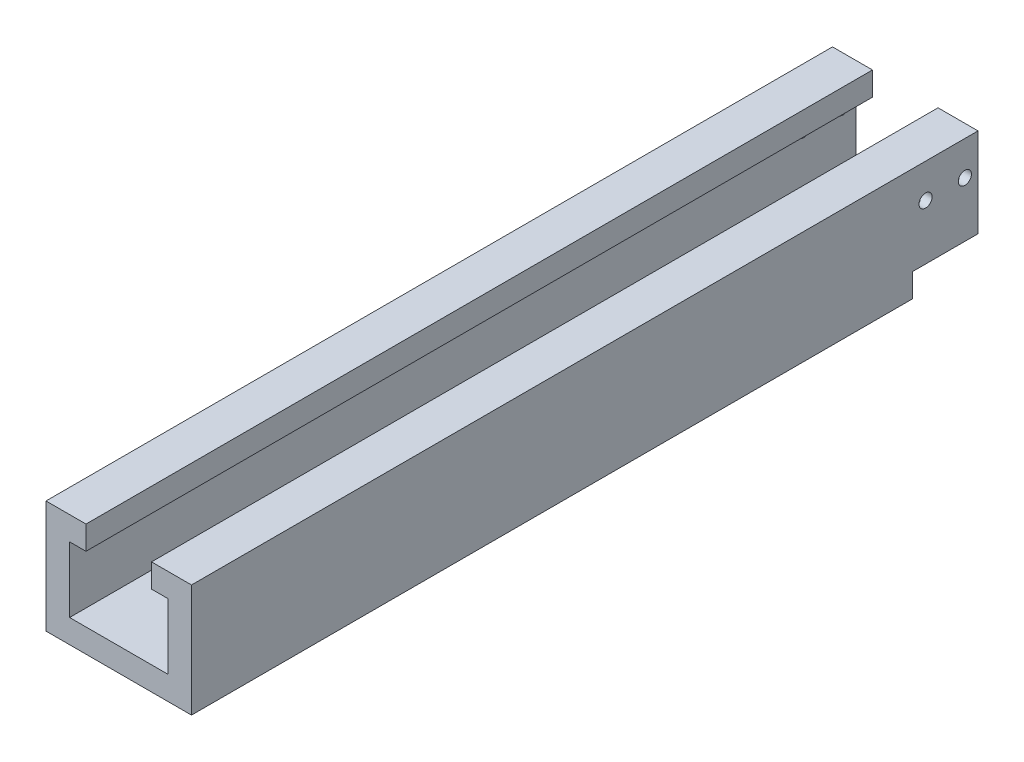
from build123d import *

# Parameters (mm, degrees)
SKETCH1_W                                  = 111
SKETCH1_H                                  = 18
BASEPLATE_DEPTH                            = 600
SKETCH2_W                                  = 18
SKETCH2_H                                  = 600
SIDE_RAIL_DEPTH                            = 50
SKETCH3_W                                  = 30.5
SKETCH3_H                                  = 600
KEEPER_RAIL_DEPTH                          = 18
SKETCH5_W                                  = 111
SKETCH5_H                                  = 50
LAP_JOINT_CUTOUT_DEPTH                     = 18
LAP_JOINT_BOLT_HOLE_PATTERN_D              = 6.6
LAP_JOINT_BOLT_HOLE_PATTERN_DEPTH          = 57
LAP_JOINT_BOLT_HOLE_PATTERN_TIP            = 1.982840043
FIXED_BEARING_BLOCK_BOLT_CLEARANCE_HOLES_D = 6.6
CROSS_DOWEL_BOLT_CLEARANCE_HOLES_D         = 10


with BuildPart() as part:
    # Sketch1 → baseplate (new body)
    with BuildSketch(Plane.XY):
        with Locations((55.5, 9)):
            Rectangle(SKETCH1_W, SKETCH1_H)
    extrude(amount=BASEPLATE_DEPTH)

    # Sketch2 → side_rail (add)
    with BuildSketch(Plane(origin=(0, 18, 0), x_dir=(1, 0, 0), z_dir=(0, 1, 0))):
        with Locations((9, -300)):
            Rectangle(SKETCH2_W, SKETCH2_H)
    side_rail = extrude(amount=SIDE_RAIL_DEPTH)

    # Sketch3 → keeper rail (add)
    with BuildSketch(Plane(origin=(0, 68, 0), x_dir=(1, 0, 0), z_dir=(0, 1, 0))):
        with Locations((15.25, -300)):
            Rectangle(SKETCH3_W, SKETCH3_H)
    keeper_rail = extrude(amount=KEEPER_RAIL_DEPTH)

    # mirror rails: side_rail, keeper rail across plane
    add(side_rail.mirror(Plane.ZY.offset(-55.5)))
    add(keeper_rail.mirror(Plane.ZY.offset(-55.5)))

    # Sketch5 → lap joint cutout (cut)
    with BuildSketch(Plane.XZ):
        with Locations((55.5, 25)):
            Rectangle(SKETCH5_W, SKETCH5_H)
    extrude(amount=-LAP_JOINT_CUTOUT_DEPTH, mode=Mode.SUBTRACT)

    # lap joint bolt hole pattern
    with Locations(Plane(origin=(0, 18, 0), x_dir=(-1, 0, 0), z_dir=(0, -1, 0))):
        with Locations((-102, -10), (-9, -40), (-102, -40), (-9, -10)):
            Hole(LAP_JOINT_BOLT_HOLE_PATTERN_D / 2, depth=LAP_JOINT_BOLT_HOLE_PATTERN_DEPTH)
            with Locations((0, 0, -(LAP_JOINT_BOLT_HOLE_PATTERN_DEPTH + LAP_JOINT_BOLT_HOLE_PATTERN_TIP / 2))):  # 118° drill point
                Cone(0, LAP_JOINT_BOLT_HOLE_PATTERN_D / 2, LAP_JOINT_BOLT_HOLE_PATTERN_TIP, mode=Mode.SUBTRACT)

    # fixed bearing block bolt clearance holes (through all)
    with Locations(Plane(origin=(0, 18, 0), x_dir=(1, 0, 0), z_dir=(0, 1, 0))):
        with Locations((37.5, -535), (73.5, -535)):
            Hole(FIXED_BEARING_BLOCK_BOLT_CLEARANCE_HOLES_D / 2)

    # cross dowel bolt clearance holes (through all)
    with Locations(Plane(origin=(111, 0, 0), x_dir=(0, 0, -1), z_dir=(1, 0, 0))):
        with Locations((-40, 60), (-10, 60)):
            Hole(CROSS_DOWEL_BOLT_CLEARANCE_HOLES_D / 2)


solid = part.part
